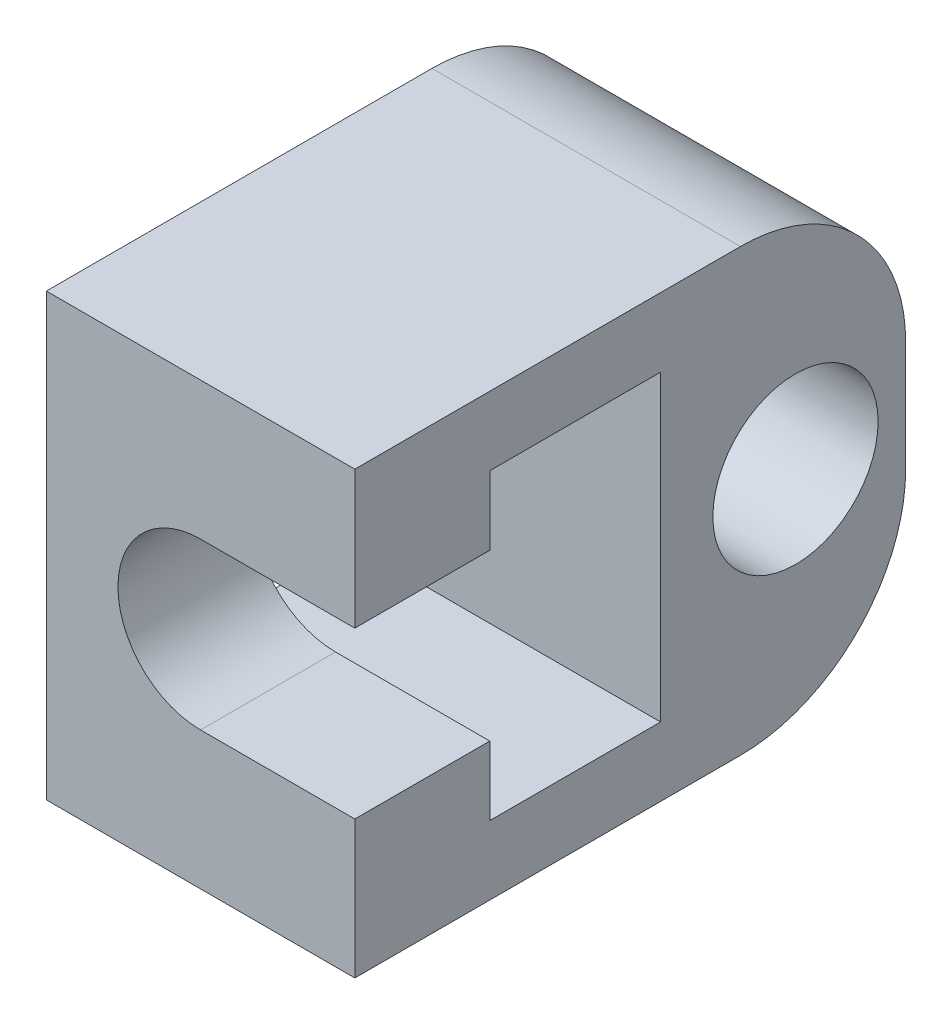
from build123d import *

# Parameters (mm, degrees)
SKETCH_1_W          = 5.6
SKETCH_1_H          = 10
EXTRUDE_1_DEPTH     = 8
SKETCH_2_W          = 3.1
SKETCH_2_H          = 5.5
CUT_EXTRUDE_1_DEPTH = 11.970870522
CUT_EXTRUDE_2_REACH = 15.109
SKETCH_3_R          = 1.5
SKETCH_4_R          = 1.5
CUT_EXTRUDE_3_DEPTH = 11.970870522
FILLET_1_R          = 3


with BuildPart() as part:
    # 草图1 → 凸台-拉伸1 (new body)
    with BuildSketch(Plane(origin=(0, 0, 0), x_dir=(1, 0, 0), z_dir=(0, 1, 0))):
        Rectangle(SKETCH_1_W, SKETCH_1_H)
    extrude(amount=EXTRUDE_1_DEPTH)

    # 草图2 → 切除-拉伸1 (cut, through all)
    with BuildSketch(Plane(origin=(2.8, 0, 0), x_dir=(0, 0, -1), z_dir=(1, 0, 0))):
        with Locations((-1, 4)):
            Rectangle(SKETCH_2_W, SKETCH_2_H)
    extrude(amount=-CUT_EXTRUDE_1_DEPTH, mode=Mode.SUBTRACT)

    # 草图3 → 切除-拉伸2 (cut, up to next)
    with BuildSketch(Plane.XY.offset(5), mode=Mode.PRIVATE) as cut_extrude_2_sk1:
        with Locations((0, 4)):
            Circle(SKETCH_3_R)
    cut_extrude_2_tool1 = extrude(cut_extrude_2_sk1.sketch, amount=-CUT_EXTRUDE_2_REACH, mode=Mode.PRIVATE) & part.part
    # 草图3 → 切除-拉伸2 (cut, up to next)
    with BuildSketch(Plane.XY.offset(5), mode=Mode.PRIVATE) as cut_extrude_2_sk2:
        with BuildLine():
            Line((2.8, 5.5), (0, 5.5))
            ThreePointArc((0, 5.5), (1.060660172, 5.060660172), (1.5, 4))
            ThreePointArc((1.5, 4), (1.060660172, 2.939339828), (0, 2.5))
            Line((0, 2.5), (2.8, 2.5))
            Line((2.8, 2.5), (2.8, 5.5))
        make_face()
    cut_extrude_2_tool2 = extrude(cut_extrude_2_sk2.sketch, amount=-CUT_EXTRUDE_2_REACH, mode=Mode.PRIVATE) & part.part
    add(cut_extrude_2_tool1.solids().sort_by_distance((0, 4, 5))[0], mode=Mode.SUBTRACT)
    add(cut_extrude_2_tool2.solids().sort_by_distance((1.954494, 4, 5))[0], mode=Mode.SUBTRACT)

    # 草图4 → 切除-拉伸3 (cut, through all)
    with BuildSketch(Plane(origin=(2.8, 0, 0), x_dir=(0, 0, -1), z_dir=(1, 0, 0))):
        with Locations((3, 4)):
            Circle(SKETCH_4_R)
    extrude(amount=-CUT_EXTRUDE_3_DEPTH, mode=Mode.SUBTRACT)

    # 圆角1
    fillet_1_edges = [part.edges().sort_by_distance(p)[0] for p in [
        (0, 8, -5),
        (0, 0, -5),
    ]]
    fillet(fillet_1_edges, radius=FILLET_1_R)


solid = part.part
